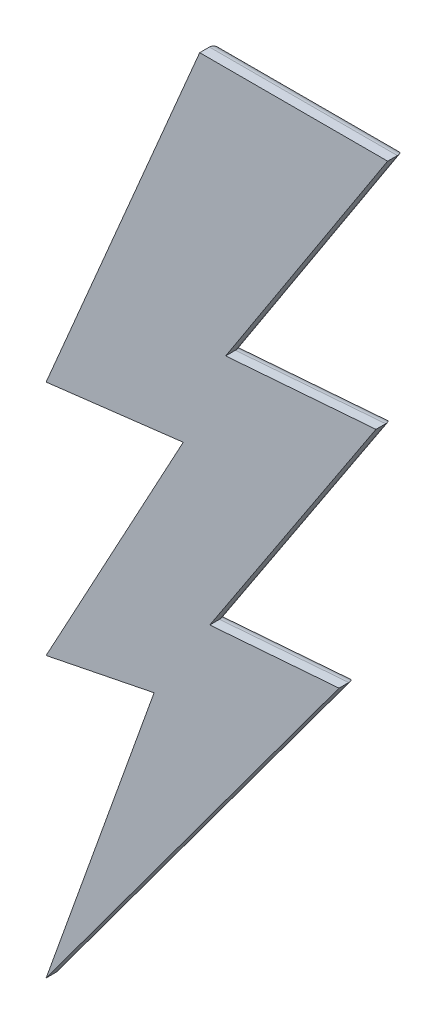
from build123d import *

# Parameters (mm, degrees)
DODANIE_WYCI_GNI_CIE1_DEPTH = 2
ZAOKR_GLENIE1_R             = 1


with BuildPart() as part:
    # Szkic1 → Dodanie-wyciągnięcie1 (new body)
    with BuildSketch(Plane.XY):
        Polygon((35, 90), (15.738496678, 90), (0, 52.892860976), (14.054590176, 54.576767478), (0, 28.625581399), (11.064716979, 30.848994041), (0, 0), (30.019363734, 40.738188486), (16.772070835, 39.719165955), (33.803123901, 65.598770402), (18.399416714, 64.413869849), align=None)
    extrude(amount=DODANIE_WYCI_GNI_CIE1_DEPTH)

    # Zaokrąglenie1
    zaokr_glenie1_edges = [part.edges().sort_by_distance(p)[0] for p in [
        (5.532358489, 15.424497021, 0),
        (5.532358489, 29.73728772, 0),
        (7.027295088, 41.601174439, 0),
        (7.027295088, 53.734814227, 0),
        (7.869248339, 71.446430488, 0),
        (25.369248339, 90, 0),
        (26.699708357, 77.206934925, 0),
        (26.101270307, 65.006320126, 0),
        (25.287597368, 52.658968179, 0),
        (23.395717284, 40.228677221, 0),
        (15.009681867, 20.369094243, 0),
    ]]
    fillet(zaokr_glenie1_edges, radius=ZAOKR_GLENIE1_R)


solid = part.part
